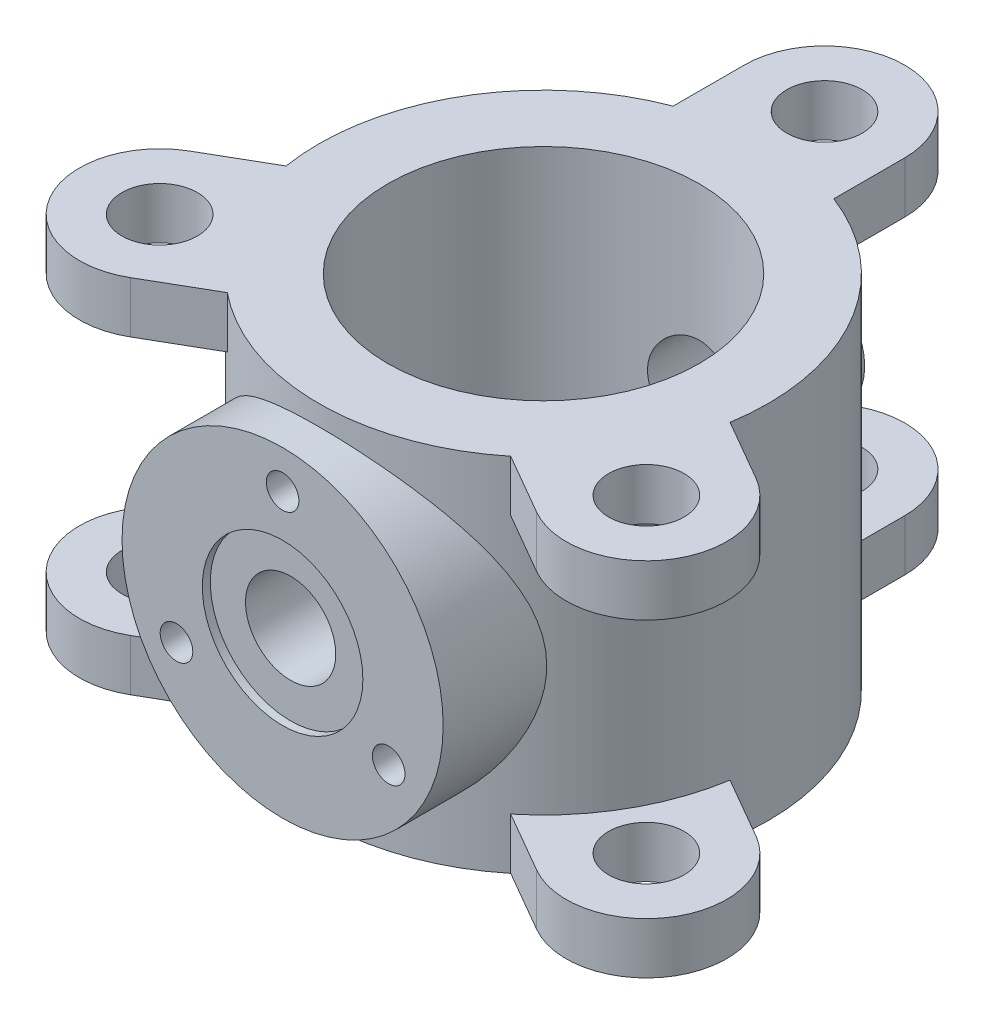
from build123d import *

# Parameters (mm, degrees)
SKETCH1_R                = 140
SKETCH1_R_2              = 97
BOSS_EXTRUDE1_DEPTH      = 112.5
BOSS_EXTRUDE2_REACH      = 353.799
BOSS_EXTRUDE2_END_RADIUS = 140
SKETCH2_R                = 100
BOSS_EXTRUDE3_REACH      = 373.324
BOSS_EXTRUDE3_END_RADIUS = 140
SKETCH3_R                = 37.5
HOLE1_D                  = 20.3
HOLE1_DEPTH              = 30
CIRPATTERN1_COUNT        = 3
HOLE2_D                  = 56.2
HOLE2_CBORE_D            = 100
HOLE2_CBORE_DEPTH        = 5
BOSS_EXTRUDE4_DEPTH      = 32
CIRPATTERN2_COUNT        = 3
SKETCH10_W               = 23.5
SKETCH10_H               = 225
HOLE3_AT_2_COUNT         = 2
HOLE3_AT_2_PITCH         = 303.108891325
HOLE3_AT_3_COUNT         = 2
HOLE3_AT_3_PITCH         = 303.108891325
MIRROR1_COPY_1_DEPTH     = 32
MIRROR1_COPY_2_DEPTH     = 32
MIRROR1_COPY_3_SKETCH_W  = 23.5
MIRROR1_COPY_3_SKETCH_H  = 225
MIRROR1_COPY_4_SKETCH_W  = 23.5
MIRROR1_COPY_4_SKETCH_H  = 225


with BuildPart() as part:
    # Sketch1 → Boss-Extrude1 (new, symmetric)
    with BuildSketch(Plane(origin=(0, 0, 0), x_dir=(1, 0, 0), z_dir=(0, 1, 0))):
        with Locations(Location((0, 0, 0), (0, 0, 270))):
            Circle(SKETCH1_R)
        with Locations(Location((0, 0, 0), (0, 0, 270))):
            Circle(SKETCH1_R_2, mode=Mode.SUBTRACT)
    extrude(amount=BOSS_EXTRUDE1_DEPTH, both=True)

    # Boss-Extrude2: up to this cylinder (the profile starts outside it)
    boss_extrude2_end = Plane(origin=(0, 0, 0), z_dir=(0, -1, 0)) * Cylinder(BOSS_EXTRUDE2_END_RADIUS, 988.598, mode=Mode.PRIVATE)
    # Sketch2 → Boss-Extrude2 (add, up to the surface)
    with BuildSketch(Plane.XY.offset(162.5), mode=Mode.PRIVATE) as boss_extrude2_sk1:
        Circle(SKETCH2_R)
    boss_extrude2_tool1 = extrude(boss_extrude2_sk1.sketch, amount=-BOSS_EXTRUDE2_REACH, mode=Mode.PRIVATE) - boss_extrude2_end
    add(boss_extrude2_tool1.solids().sort_by_distance((0, 0, 162.5))[0])

    # Boss-Extrude3: up to this cylinder (the profile starts outside it)
    boss_extrude3_end = Plane(origin=(0, 0, 0), z_dir=(0, -1, 0)) * Cylinder(BOSS_EXTRUDE3_END_RADIUS, 1027.648, mode=Mode.PRIVATE)
    # Sketch3 → Boss-Extrude3 (add, up to the surface)
    with BuildSketch(Plane.XY.offset(-162.5), mode=Mode.PRIVATE) as boss_extrude3_sk1:
        with Locations(Location((0, 0, 0), (0, 0, 90))):
            Circle(SKETCH3_R)
    boss_extrude3_tool1 = extrude(boss_extrude3_sk1.sketch, amount=BOSS_EXTRUDE3_REACH, mode=Mode.PRIVATE) - boss_extrude3_end
    add(boss_extrude3_tool1.solids().sort_by_distance((0, 0, -162.5))[0])

    # Hole1
    with Locations(Plane.XY.offset(162.5)):
        with Locations((0, 76.3)):
            hole1 = Hole(HOLE1_D / 2, depth=HOLE1_DEPTH)

    # CirPattern1: Hole1 ×3 about axis
    cirpattern1_axis = Axis((0, 0, 0), (0, 0, 1))
    for i in range(1, CIRPATTERN1_COUNT):
        add(hole1.rotate(cirpattern1_axis, i * 360 / CIRPATTERN1_COUNT), mode=Mode.SUBTRACT)

    # Hole2 (through all)
    with Locations(Plane.XY.offset(162.5)):
        with Locations((0, 0)):
            CounterBoreHole(HOLE2_D / 2, HOLE2_CBORE_D / 2, HOLE2_CBORE_DEPTH)

    # Sketch8 → Boss-Extrude4 (add)
    with BuildSketch(Plane(origin=(0, 112.5, 0), x_dir=(1, 0, 0), z_dir=(0, 1, 0))):
        with BuildLine():
            Line((-50, 175), (-50, 130.766968306))
            ThreePointArc((-50, 130.766968306), (0, 140), (50, 130.766968306))
            Line((50, 130.766968306), (50, 175))
            ThreePointArc((50, 175), (0, 225), (-50, 175))
        make_face()
    boss_extrude4 = extrude(amount=-BOSS_EXTRUDE4_DEPTH)

    # CirPattern2: Boss-Extrude4 ×3 about axis
    cirpattern2_axis = Axis((0, 0, 0), (0, 1, 0))
    for i in range(1, CIRPATTERN2_COUNT):
        add(boss_extrude4.rotate(cirpattern2_axis, i * 360 / CIRPATTERN2_COUNT))

    # Sketch10 → Hole3 (revolve, cut)
    with BuildSketch(Plane(origin=(0, 112.5, -175), x_dir=(0, 0, 1), z_dir=(1, 0, 0))):
        with Locations((11.75, 112.5)):
            Rectangle(SKETCH10_W, SKETCH10_H)
    hole3 = revolve(axis=Axis((0, 2.5, -175), (0, 1, 0)), mode=Mode.SUBTRACT)

    # Hole3 at 2: Hole3 ×2
    with Locations(*[Vector(0.500000000000004, 0, 0.8660254037844364) * (i * HOLE3_AT_2_PITCH) for i in range(1, HOLE3_AT_2_COUNT)]):
        add(hole3, mode=Mode.SUBTRACT)

    # Hole3 at 3: Hole3 ×2
    with Locations(*[Vector(-0.49999999999999806, 0, 0.8660254037844397) * (i * HOLE3_AT_3_PITCH) for i in range(1, HOLE3_AT_3_COUNT)]):
        add(hole3, mode=Mode.SUBTRACT)

    # Mirror1: Boss-Extrude4, Hole3 across plane
    add(boss_extrude4.mirror(Plane.ZX))
    add(hole3.mirror(Plane.ZX), mode=Mode.SUBTRACT)

    # Mirror1 copy 1 sketch → Mirror1 copy 1 (add)
    with BuildSketch(Plane(origin=(0, -112.5, 0), x_dir=(-0.4999999999999998, 0, -0.8660254037844387), z_dir=(0, -1, 0))):
        with BuildLine():
            Line((-50, -175), (-50, -130.766968306))
            ThreePointArc((-50, -130.766968306), (0, -140), (50, -130.766968306))
            Line((50, -130.766968306), (50, -175))
            ThreePointArc((50, -175), (0, -225), (-50, -175))
        make_face()
    extrude(amount=-MIRROR1_COPY_1_DEPTH)

    # Mirror1 copy 2 sketch → Mirror1 copy 2 (add)
    with BuildSketch(Plane(origin=(0, -112.5, 0), x_dir=(-0.5000000000000004, 0, 0.8660254037844384), z_dir=(0, -1, 0))):
        with BuildLine():
            Line((-50, -175), (-50, -130.766968306))
            ThreePointArc((-50, -130.766968306), (0, -140), (50, -130.766968306))
            Line((50, -130.766968306), (50, -175))
            ThreePointArc((50, -175), (0, -225), (-50, -175))
        make_face()
    extrude(amount=-MIRROR1_COPY_2_DEPTH)

    # Mirror1 copy 3 sketch → Mirror1 copy 3 (revolve, cut)
    with BuildSketch(Plane(origin=(151.554445662, -112.5, 87.5), x_dir=(0, 0, 1), z_dir=(1, 0, 0))):
        with Locations((11.75, -112.5)):
            Rectangle(MIRROR1_COPY_3_SKETCH_W, MIRROR1_COPY_3_SKETCH_H)
    revolve(axis=Axis((151.554445662, -2.5, 87.5), (0, 1, 0)), mode=Mode.SUBTRACT)

    # Mirror1 copy 4 sketch → Mirror1 copy 4 (revolve, cut)
    with BuildSketch(Plane(origin=(-151.554445662, -112.5, 87.5), x_dir=(0, 0, 1), z_dir=(1, 0, 0))):
        with Locations((11.75, -112.5)):
            Rectangle(MIRROR1_COPY_4_SKETCH_W, MIRROR1_COPY_4_SKETCH_H)
    revolve(axis=Axis((-151.554445662, -2.5, 87.5), (0, 1, 0)), mode=Mode.SUBTRACT)


solid = part.part
